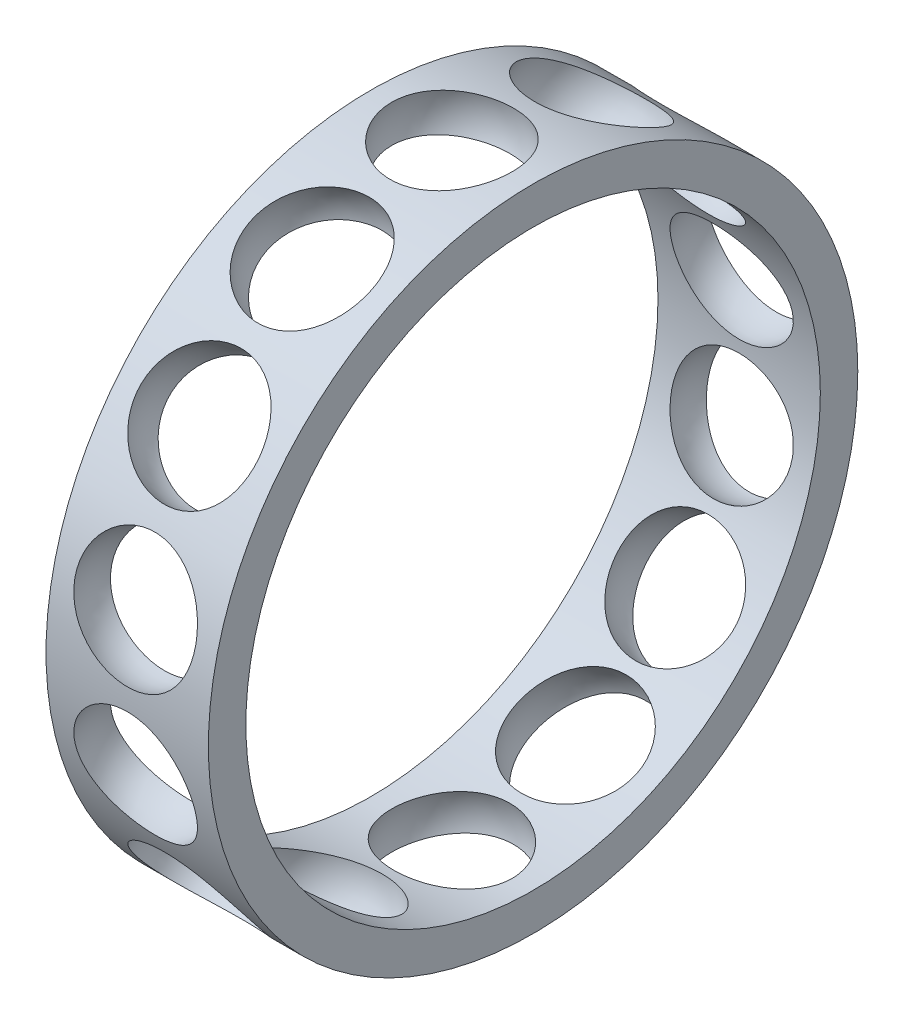
from build123d import *

# Parameters (mm, degrees)
ESQUISSE1_W                  = 13
ESQUISSE1_H                  = 3
R_P_TITION_CIRCULAIRE1_COUNT = 14


with BuildPart() as part:
    # Esquisse1 → Base-Révolution (revolve)
    with BuildSketch(Plane.XY, mode=Mode.PRIVATE) as base_r_volution_sk:
        with Locations((11.791631281, 24.5)):
            Rectangle(ESQUISSE1_W, ESQUISSE1_H)
    revolve(base_r_volution_sk.sketch.rotate(Axis((25, 0, 0), (-1, 0, 0)), 90), axis=Axis((25, 0, 0), (-1, 0, 0)))

    # Esquisse2 → Enlèvement de matière-Révolution1 (revolve, cut)
    with BuildSketch(Plane.XY):
        with BuildLine():
            Line((11.791631281, 29.55), (11.791631281, 19.45))
            ThreePointArc((11.791631281, 19.45), (16.841631281, 24.5), (11.791631281, 29.55))
        make_face()
    enl_vement_de_mati_re_r_volution1 = revolve(axis=Axis((11.791631281, 32.288000836, 0), (0, -1, 0)), mode=Mode.SUBTRACT)

    # Répétition circulaire1: Enlèvement de matière-Révolution1 ×14 about axis
    r_p_tition_circulaire1_axis = Axis((0, 0, 0), (1, 0, 0))
    for i in range(1, R_P_TITION_CIRCULAIRE1_COUNT):
        add(enl_vement_de_mati_re_r_volution1.rotate(r_p_tition_circulaire1_axis, i * 360 / R_P_TITION_CIRCULAIRE1_COUNT), mode=Mode.SUBTRACT)


solid = part.part
